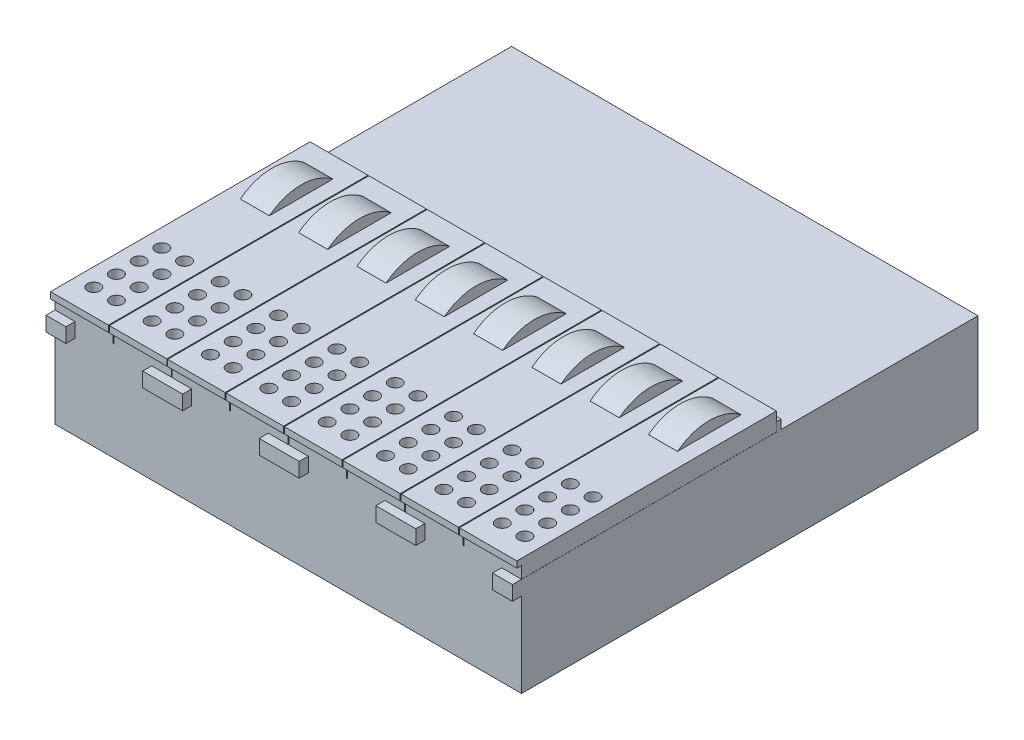
from build123d import *

# Parameters (mm, degrees)
BOSS_EXTRUDE1_DEPTH = 51.4
CUT_EXTRUDE1_REACH  = 75.757
SKETCH3_W           = 1.6125
SKETCH3_H           = 7
LPATTERN1_COUNT     = 8
LPATTERN1_PITCH     = 6.425
SKETCH4_W           = 8.45
SKETCH4_H           = 1.6
CUT_EXTRUDE2_DEPTH  = 1
LPATTERN2_COUNT     = 8
LPATTERN2_PITCH     = 12.85
SKETCH5_R           = 0.7
SKETCH5_W           = 0.1
SKETCH5_H           = 28.6
CUT_EXTRUDE3_DEPTH  = 2
LPATTERN3_COUNT     = 8
LPATTERN3_PITCH     = 6.43


with BuildPart() as part:
    # Sketch2 → Boss-Extrude1 (new body)
    with BuildSketch(Plane(origin=(0, 0, 0), x_dir=(0, 0, -1), z_dir=(1, 0, 0))):
        with BuildLine():
            Line((-31.5, 12.9), (-24.5, 12.9))
            ThreePointArc((-24.5, 12.9), (-28, 14.1), (-31.5, 12.9))
        make_face()
        Polygon((-50.3, 9.3), (-50.3, 0), (0, 0), (0, 10.9), (-21.7, 10.9), (-21.7, 11.9), (-22.2, 11.9), (-22.2, 12.9), (-50.8, 12.9), (-50.8, 12.2), (-50.3, 12.2), (-50.3, 10.9), (-51.3, 10.9), (-51.3, 9.3), align=None)
    extrude(amount=BOSS_EXTRUDE1_DEPTH)

    # Sketch3 → Cut-Extrude1 (cut, up to next)
    with BuildSketch(Plane(origin=(0, 12.9, 0), x_dir=(1, 0, 0), z_dir=(0, 1, 0)), mode=Mode.PRIVATE) as cut_extrude1_sk1:
        with Locations((0.80625, -28)):
            Rectangle(SKETCH3_W, SKETCH3_H)
    cut_extrude1_tool1 = extrude(cut_extrude1_sk1.sketch, amount=CUT_EXTRUDE1_REACH, mode=Mode.PRIVATE) & part.part
    # Sketch3 → Cut-Extrude1 (cut, up to next)
    with BuildSketch(Plane(origin=(0, 12.9, 0), x_dir=(1, 0, 0), z_dir=(0, 1, 0)), mode=Mode.PRIVATE) as cut_extrude1_sk2:
        with Locations((5.61875, -28)):
            Rectangle(SKETCH3_W, SKETCH3_H)
    cut_extrude1_tool2 = extrude(cut_extrude1_sk2.sketch, amount=CUT_EXTRUDE1_REACH, mode=Mode.PRIVATE) & part.part
    cut_extrude1_1 = cut_extrude1_tool1.solids().sort_by_distance((0.80625, 12.9, 28))[0]
    add(cut_extrude1_1, mode=Mode.SUBTRACT)
    cut_extrude1_2 = cut_extrude1_tool2.solids().sort_by_distance((5.61875, 12.9, 28))[0]
    add(cut_extrude1_2, mode=Mode.SUBTRACT)
    cut_extrude1 = cut_extrude1_1 + cut_extrude1_2  # Cut-Extrude1 as one shape, for the pattern or mirror that repeats it

    # LPattern1: Cut-Extrude1 ×8
    with Locations(*[(i * LPATTERN1_PITCH, 0, 0) for i in range(1, LPATTERN1_COUNT)]):
        add(cut_extrude1, mode=Mode.SUBTRACT)

    # Sketch4 → Cut-Extrude2 (cut)
    with BuildSketch(Plane.XY.offset(51.3)):
        with Locations((6.425, 10.1)):
            Rectangle(SKETCH4_W, SKETCH4_H)
    cut_extrude2 = extrude(amount=-CUT_EXTRUDE2_DEPTH, mode=Mode.SUBTRACT)

    # LPattern2: Cut-Extrude2 ×8
    with Locations(*[(i * LPATTERN2_PITCH, 0, 0) for i in range(1, LPATTERN2_COUNT)]):
        add(cut_extrude2, mode=Mode.SUBTRACT)

    # Sketch5 → Cut-Extrude3 (cut)
    with BuildSketch(Plane(origin=(0, 12.9, 0), x_dir=(1, 0, 0), z_dir=(0, 1, 0))):
        with Locations(Location((1.965, -40.5, 0), (0, 0, 270))):
            Circle(SKETCH5_R)
        with Locations(Location((4.465, -40.5, 0), (0, 0, 270))):
            Circle(SKETCH5_R)
        with Locations(Location((4.465, -43, 0), (0, 0, 270))):
            Circle(SKETCH5_R)
        with Locations(Location((4.465, -45.5, 0), (0, 0, 270))):
            Circle(SKETCH5_R)
        with Locations(Location((4.465, -48, 0), (0, 0, 270))):
            Circle(SKETCH5_R)
        with Locations(Location((1.965, -43, 0), (0, 0, 270))):
            Circle(SKETCH5_R)
        with Locations(Location((1.965, -45.5, 0), (0, 0, 270))):
            Circle(SKETCH5_R)
        with Locations(Location((1.965, -48, 0), (0, 0, 270))):
            Circle(SKETCH5_R)
        with Locations((6.43, -36.5)):
            Rectangle(SKETCH5_W, SKETCH5_H)
    cut_extrude3 = extrude(amount=-CUT_EXTRUDE3_DEPTH, mode=Mode.SUBTRACT)

    # LPattern3: Cut-Extrude3 ×8
    with Locations(*[(i * LPATTERN3_PITCH, 0, 0) for i in range(1, LPATTERN3_COUNT)]):
        add(cut_extrude3, mode=Mode.SUBTRACT)


solid = part.part
